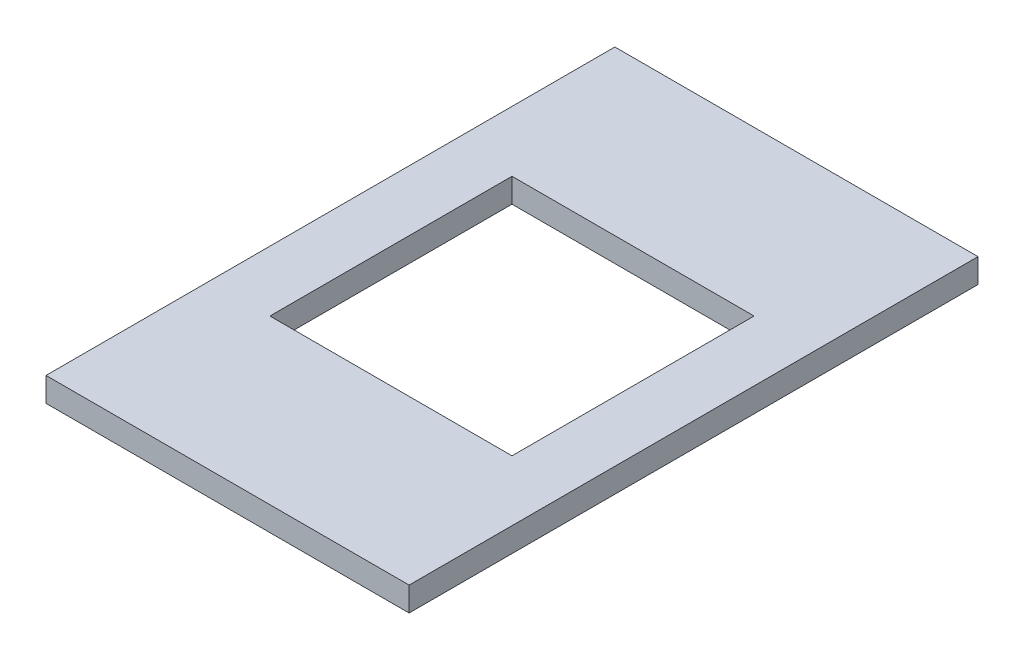
from build123d import *

# Parameters (mm, degrees)
SKETCH1_W           = 150
SKETCH1_H           = 30
BOSS_EXTRUDE1_DEPTH = 10
SKETCH9_W           = 150
SKETCH9_H           = 235
SKETCH9_W_2         = 100
SKETCH9_H_2         = 100
BOSS_EXTRUDE3_DEPTH = 10
SKETCH25_W          = 150
SKETCH25_H          = 30
CUT_EXTRUDE2_DEPTH  = 10


with BuildPart() as part:
    # Sketch1 → Boss-Extrude1 (new body)
    with BuildSketch(Plane(origin=(0, 0, 0), x_dir=(1, 0, 0), z_dir=(0, 1, 0))):
        with Locations((-75, 15)):
            Rectangle(SKETCH1_W, SKETCH1_H)
    extrude(amount=BOSS_EXTRUDE1_DEPTH)

    # Sketch9 → Boss-Extrude3 (add)
    with BuildSketch(Plane.XZ):
        with Locations((-75, -15)):
            Rectangle(SKETCH9_W, SKETCH9_H)
        with Locations((-75, -15)):
            Rectangle(SKETCH9_W_2, SKETCH9_H_2, mode=Mode.SUBTRACT)
    extrude(amount=BOSS_EXTRUDE3_DEPTH)

    # Sketch25 → Cut-Extrude2 (cut)
    with BuildSketch(Plane(origin=(0, 0, 0), x_dir=(1, 0, 0), z_dir=(0, 1, 0))):
        with Locations((-75, 15)):
            Rectangle(SKETCH25_W, SKETCH25_H)
    extrude(amount=CUT_EXTRUDE2_DEPTH, mode=Mode.SUBTRACT)


solid = part.part
